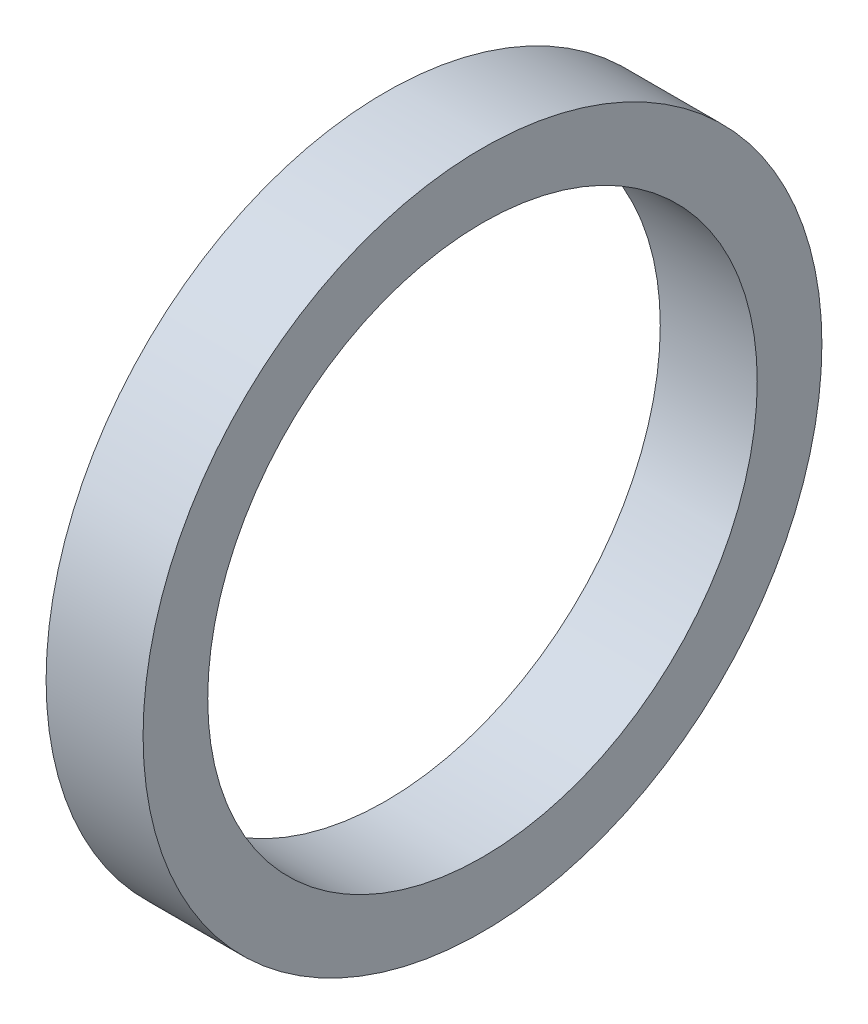
from build123d import *

# Parameters (mm, degrees)
SKETCH1_R           = 33.3375
SKETCH1_R_2         = 26.9875
BOSS_EXTRUDE1_DEPTH = 4.7625


with BuildPart() as part:
    # Sketch1 → Boss-Extrude1 (new, symmetric)
    with BuildSketch(Plane(origin=(0, 0, 0), x_dir=(0, 0, -1), z_dir=(1, 0, 0))):
        with Locations(Location((0, 0, 0), (0, 0, 180))):
            Circle(SKETCH1_R)
        with Locations(Location((0, 0, 0), (0, 0, 180))):
            Circle(SKETCH1_R_2, mode=Mode.SUBTRACT)
    extrude(amount=BOSS_EXTRUDE1_DEPTH, both=True)


solid = part.part
